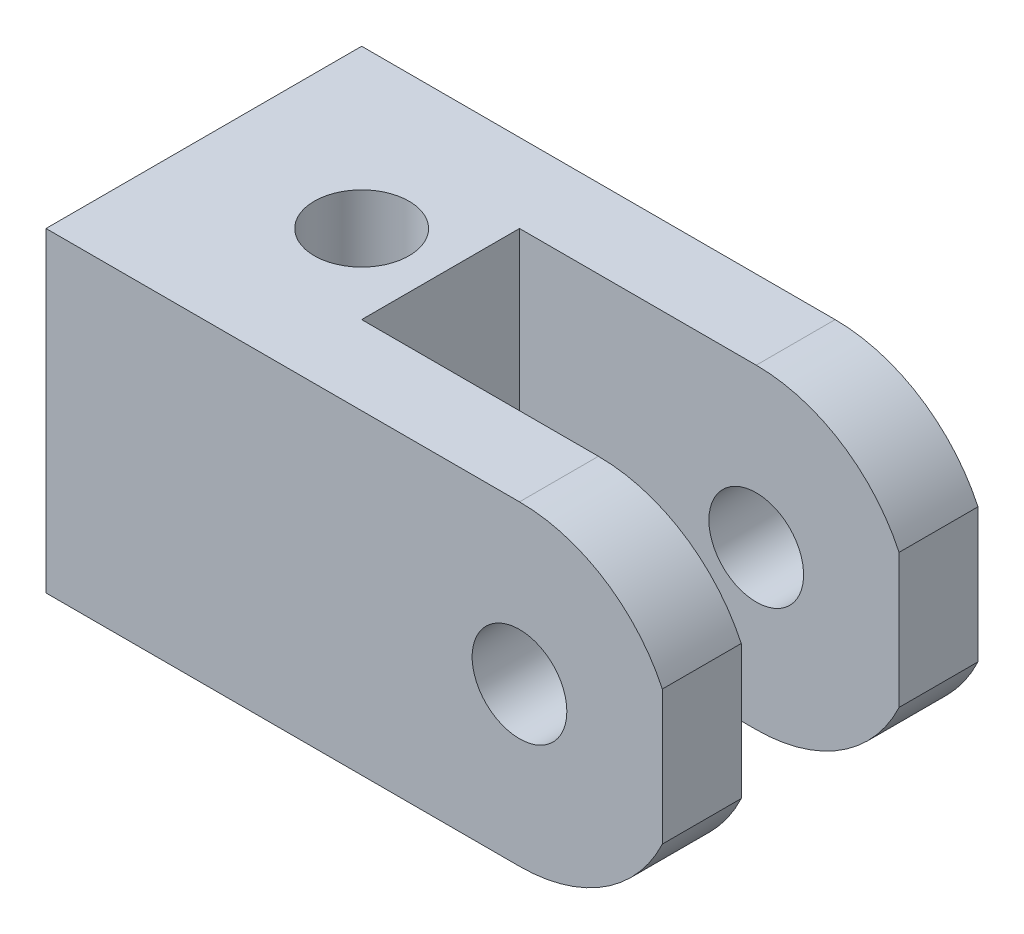
from build123d import *

# Parameters (mm, degrees)
CROQUIS1_W              = 20
CROQUIS1_H              = 10
CROQUIS1_R              = 1.5
SALIENTE_EXTRUIR1_DEPTH = 10
CROQUIS2_R              = 1.5
CORTAR_EXTRUIR1_DEPTH   = 14
CROQUIS3_W              = 5
CROQUIS3_H              = 10
CORTAR_EXTRUIR2_DEPTH   = 12.5
CUT_EXTRUDE1_DEPTH      = 10


with BuildPart() as part:
    # Croquis1 → Saliente-Extruir1 (new body)
    with BuildSketch(Plane.XY):
        with Locations((-5, 0)):
            Rectangle(CROQUIS1_W, CROQUIS1_H)
        Circle(CROQUIS1_R, mode=Mode.SUBTRACT)
    extrude(amount=SALIENTE_EXTRUIR1_DEPTH)

    # Croquis2 → Cortar-Extruir1 (cut)
    with BuildSketch(Plane(origin=(0, 5, 0), x_dir=(1, 0, 0), z_dir=(0, 1, 0))):
        with Locations(Location((-10, -5, 0), (0, 0, 180))):
            Circle(CROQUIS2_R)
    extrude(amount=-CORTAR_EXTRUIR1_DEPTH, mode=Mode.SUBTRACT)

    # Croquis3 → Cortar-Extruir2 (cut)
    with BuildSketch(Plane(origin=(5, 0, 0), x_dir=(0, 0, -1), z_dir=(1, 0, 0))):
        with Locations((-5, 0)):
            Rectangle(CROQUIS3_W, CROQUIS3_H)
    extrude(amount=-CORTAR_EXTRUIR2_DEPTH, mode=Mode.SUBTRACT)

    # Sketch1 → Cut-Extrude1 (cut)
    with BuildSketch(Plane.XY.offset(10)):
        with BuildLine():
            Line((0, 5), (5.992915048, 5))
            Line((5.992915048, 5), (5.992915048, -6.748814934))
            Line((5.992915048, -6.748814934), (0, -5))
            ThreePointArc((0, -5), (2.680080756, -4.221038633), (4.525089765, -2.126866856))
            Line((4.525089765, -2.126866856), (4.525089765, 2.126866856))
            ThreePointArc((4.525089765, 2.126866856), (2.680080756, 4.221038633), (0, 5))
        make_face()
    extrude(amount=-CUT_EXTRUDE1_DEPTH, mode=Mode.SUBTRACT)


solid = part.part
